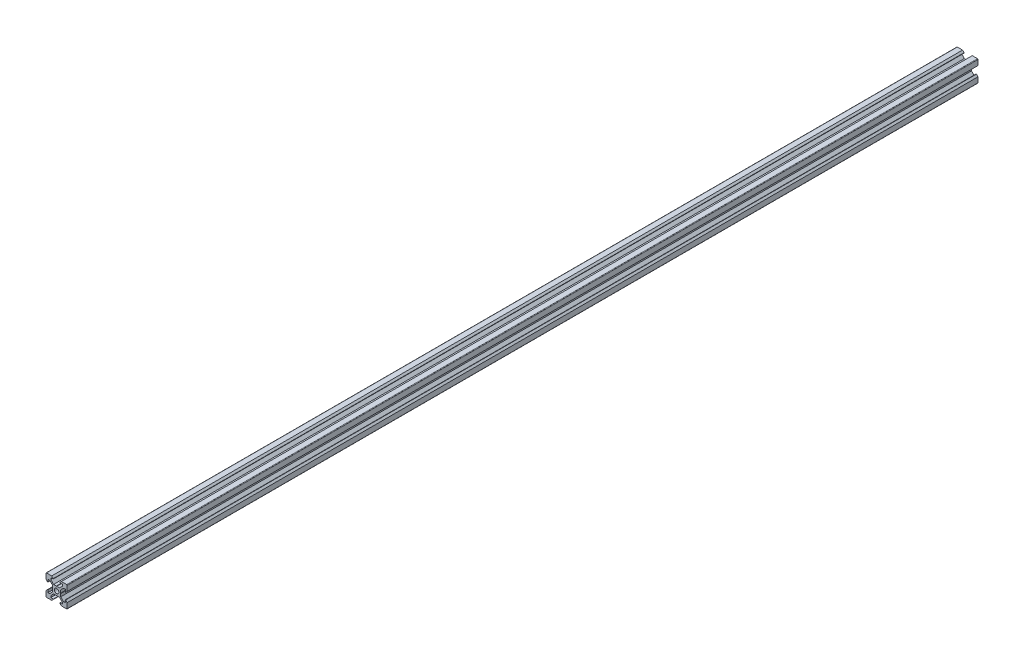
from build123d import *

# Parameters (mm, degrees)
SKETCH1_R           = 2.1
BOSS_EXTRUDE1_DEPTH = 860


with BuildPart() as part:
    # Sketch1 → Boss-Extrude1 (new body)
    with BuildSketch(Plane.XY):
        with BuildLine():
            Line((4.58, -10), (9.5, -10))
            ThreePointArc((9.5, -10), (9.853553391, -9.853553391), (10, -9.5))
            Line((10, -9.5), (10, -4.58))
            Line((10, -4.58), (8.545, -3.125))
            Line((8.545, -3.125), (8.2, -3.125))
            Line((8.2, -3.125), (8.2, -5.5))
            Line((8.2, -5.5), (6.560660172, -5.5))
            Line((6.560660172, -5.5), (3.9, -2.839339828))
            Line((3.9, -2.839339828), (3.9, -0.21))
            Line((3.9, -0.21), (3.69, 0))
            Line((3.69, 0), (3.9, 0.21))
            Line((3.9, 0.21), (3.9, 2.839339828))
            Line((3.9, 2.839339828), (6.560660172, 5.5))
            Line((6.560660172, 5.5), (8.2, 5.5))
            Line((8.2, 5.5), (8.2, 3.125))
            Line((8.2, 3.125), (8.545, 3.125))
            Line((8.545, 3.125), (10, 4.58))
            Line((10, 4.58), (10, 9.5))
            ThreePointArc((10, 9.5), (9.853553391, 9.853553391), (9.5, 10))
            Line((9.5, 10), (4.58, 10))
            Line((4.58, 10), (3.125, 8.545))
            Line((3.125, 8.545), (3.125, 8.2))
            Line((3.125, 8.2), (5.5, 8.2))
            Line((5.5, 8.2), (5.5, 6.560660172))
            Line((5.5, 6.560660172), (2.839339828, 3.9))
            Line((2.839339828, 3.9), (0.21, 3.9))
            Line((0.21, 3.9), (0, 3.69))
            Line((0, 3.69), (-0.21, 3.9))
            Line((-0.21, 3.9), (-2.839339828, 3.9))
            Line((-2.839339828, 3.9), (-5.5, 6.560660172))
            Line((-5.5, 6.560660172), (-5.5, 8.2))
            Line((-5.5, 8.2), (-3.125, 8.2))
            Line((-3.125, 8.2), (-3.125, 8.545))
            Line((-3.125, 8.545), (-4.58, 10))
            Line((-4.58, 10), (-9.5, 10))
            ThreePointArc((-9.5, 10), (-9.853553391, 9.853553391), (-10, 9.5))
            Line((-10, 9.5), (-10, 4.58))
            Line((-10, 4.58), (-8.545, 3.125))
            Line((-8.545, 3.125), (-8.2, 3.125))
            Line((-8.2, 3.125), (-8.2, 5.5))
            Line((-8.2, 5.5), (-6.560660172, 5.5))
            Line((-6.560660172, 5.5), (-3.9, 2.839339828))
            Line((-3.9, 2.839339828), (-3.9, 0.21))
            Line((-3.9, 0.21), (-3.69, 0))
            Line((-3.69, 0), (-3.9, -0.21))
            Line((-3.9, -0.21), (-3.9, -2.839339828))
            Line((-3.9, -2.839339828), (-6.560660172, -5.5))
            Line((-6.560660172, -5.5), (-8.2, -5.5))
            Line((-8.2, -5.5), (-8.2, -3.125))
            Line((-8.2, -3.125), (-8.545, -3.125))
            Line((-8.545, -3.125), (-10, -4.58))
            Line((-10, -4.58), (-10, -9.5))
            ThreePointArc((-10, -9.5), (-9.853553391, -9.853553391), (-9.5, -10))
            Line((-9.5, -10), (-4.58, -10))
            Line((-4.58, -10), (-3.125, -8.545))
            Line((-3.125, -8.545), (-3.125, -8.2))
            Line((-3.125, -8.2), (-5.5, -8.2))
            Line((-5.5, -8.2), (-5.5, -6.560660172))
            Line((-5.5, -6.560660172), (-2.839339828, -3.9))
            Line((-2.839339828, -3.9), (-0.21, -3.9))
            Line((-0.21, -3.9), (0, -3.69))
            Line((0, -3.69), (0.21, -3.9))
            Line((0.21, -3.9), (2.839339828, -3.9))
            Line((2.839339828, -3.9), (5.5, -6.560660172))
            Line((5.5, -6.560660172), (5.5, -8.2))
            Line((5.5, -8.2), (3.125, -8.2))
            Line((3.125, -8.2), (3.125, -8.545))
            Line((3.125, -8.545), (4.58, -10))
        make_face()
        Circle(SKETCH1_R, mode=Mode.SUBTRACT)
    extrude(amount=BOSS_EXTRUDE1_DEPTH)


solid = part.part
